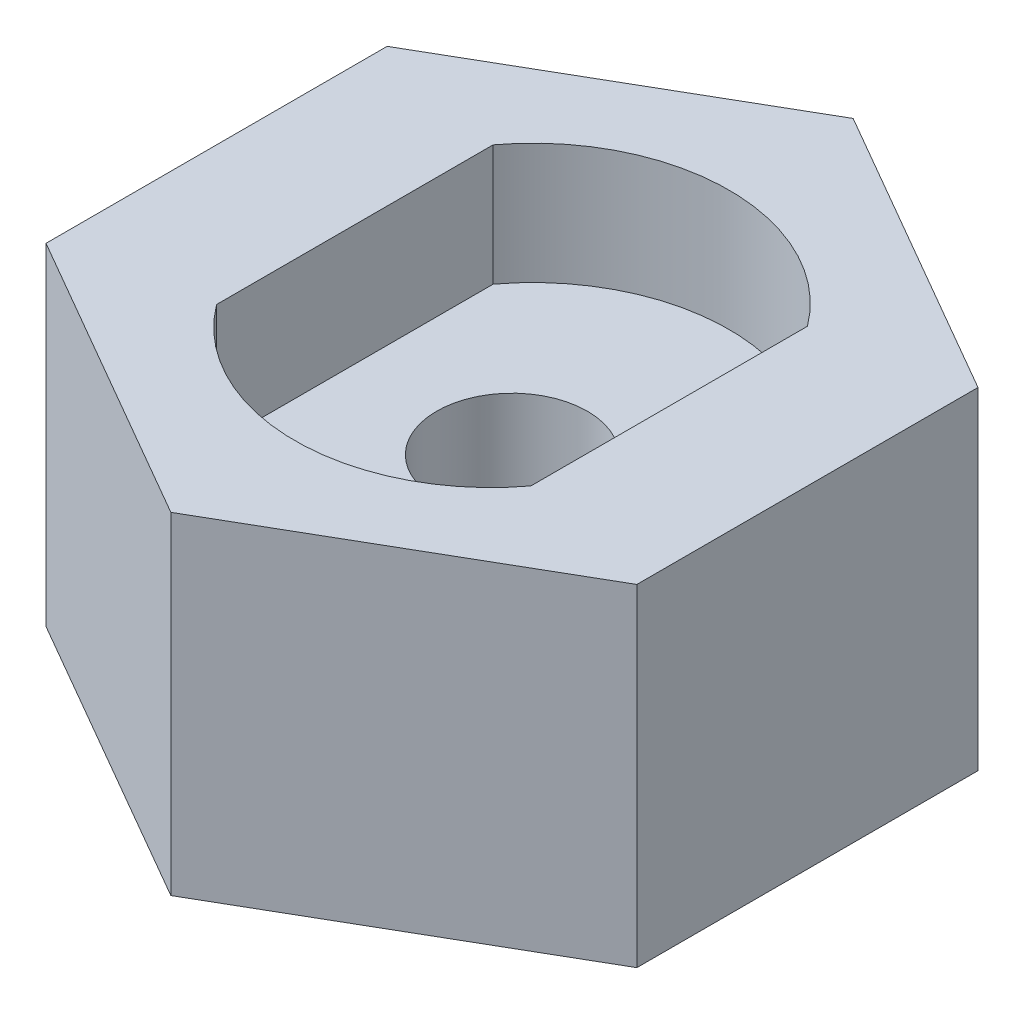
from build123d import *

# Parameters (mm, degrees)
BOSS_EXTRUDE1_DEPTH   = 6.6
CUT_EXTRUDE1_DEPTH    = 2.4
F_3_0MM_DOWEL_HOLE1_D = 3


with BuildPart() as part:
    # Sketch1 → Boss-Extrude1 (new body)
    with BuildSketch(Plane(origin=(0, 0, 0), x_dir=(1, 0, 0), z_dir=(0, 1, 0))):
        Polygon((-5.875, 3.391932831), (-5.875, -3.391932831), (0, -6.783865663), (5.875, -3.391932831), (5.875, 3.391932831), (0, 6.783865663), align=None)
    extrude(amount=BOSS_EXTRUDE1_DEPTH)

    # Sketch2 → Cut-Extrude1 (cut)
    with BuildSketch(Plane(origin=(0, 6.6, 0), x_dir=(1, 0, 0), z_dir=(0, 1, 0))):
        with BuildLine():
            Line((-3.125, 2.75), (-3.125, -2.75))
            ThreePointArc((-3.125, -2.75), (0, -4.316681548), (3.125, -2.75))
            Line((3.125, -2.75), (3.125, 2.75))
            ThreePointArc((3.125, 2.75), (0, 4.316681548), (-3.125, 2.75))
        make_face()
    extrude(amount=-CUT_EXTRUDE1_DEPTH, mode=Mode.SUBTRACT)

    # Ø3.0mm Dowel Hole1 (through all)
    with Locations(Plane(origin=(0, 0, 0), x_dir=(-1, 0, 0), z_dir=(0, -1, 0))):
        with Locations((0, 0)):
            Hole(F_3_0MM_DOWEL_HOLE1_D / 2)


solid = part.part
